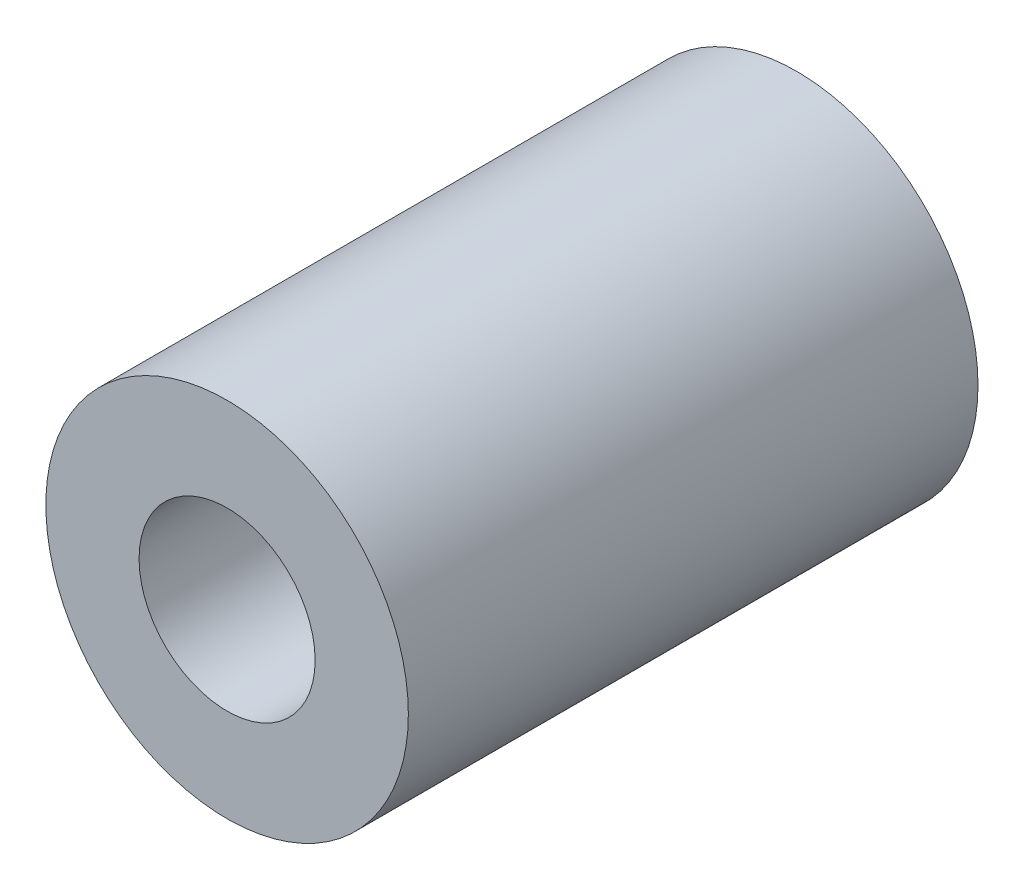
from build123d import *

# Parameters (mm, degrees)
SKETCH1_R           = 3.5
SKETCH1_R_2         = 1.7
BOSS_EXTRUDE1_DEPTH = 11


with BuildPart() as part:
    # Sketch1 → Boss-Extrude1 (new body)
    with BuildSketch(Plane.XY):
        Circle(SKETCH1_R)
        Circle(SKETCH1_R_2, mode=Mode.SUBTRACT)
    extrude(amount=BOSS_EXTRUDE1_DEPTH)


solid = part.part
